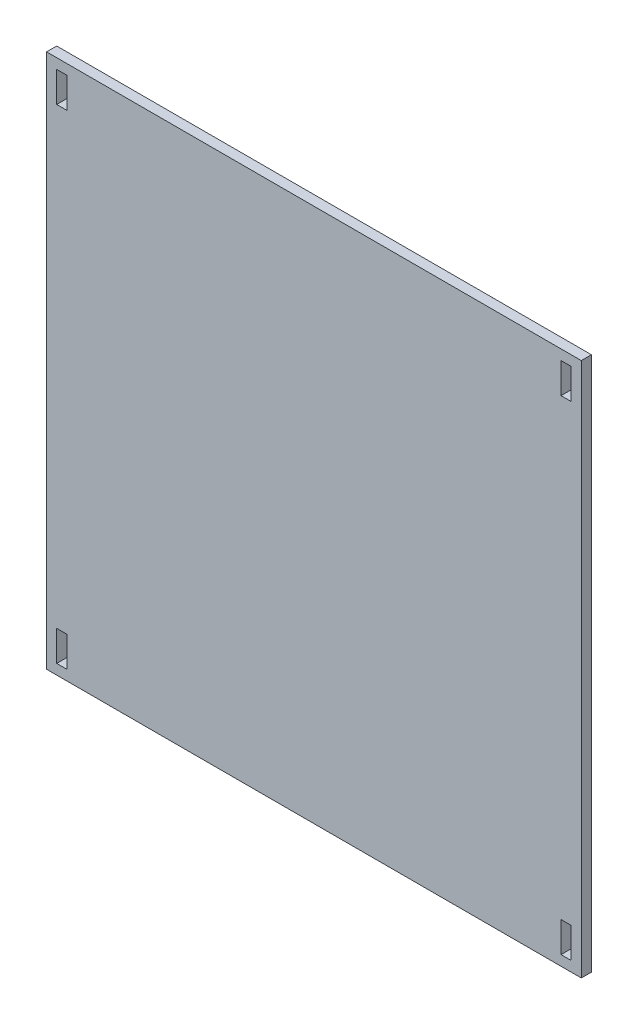
from build123d import *

# Parameters (mm, degrees)
SKETCH1_W           = 528
SKETCH1_H           = 528
BOSS_EXTRUDE1_DEPTH = 10
SKETCH2_W           = 10
SKETCH2_H           = 30
CUT_EXTRUDE1_DEPTH  = 10


with BuildPart() as part:
    # Sketch1 → Boss-Extrude1 (new body)
    with BuildSketch(Plane.XY):
        with Locations((-264, 264)):
            Rectangle(SKETCH1_W, SKETCH1_H)
    extrude(amount=BOSS_EXTRUDE1_DEPTH)

    # Sketch2 → Cut-Extrude1 (cut)
    with BuildSketch(Plane(origin=(0, 0, 0), x_dir=(-1, 0, 0), z_dir=(0, 0, -1))):
        with Locations((513, 503)):
            Rectangle(SKETCH2_W, SKETCH2_H)
        with Locations((513, 25)):
            Rectangle(SKETCH2_W, SKETCH2_H)
        with Locations((15, 25)):
            Rectangle(SKETCH2_W, SKETCH2_H)
        with Locations((15, 503)):
            Rectangle(SKETCH2_W, SKETCH2_H)
    extrude(amount=-CUT_EXTRUDE1_DEPTH, mode=Mode.SUBTRACT)


solid = part.part
